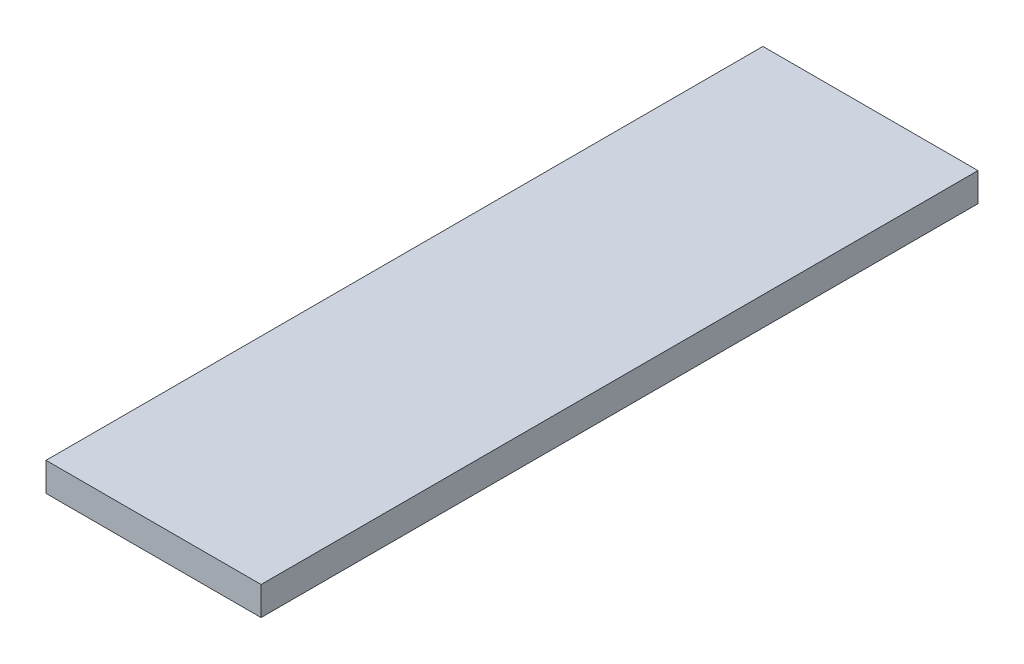
from build123d import *

# Parameters (mm, degrees)
SKETCH1_W           = 150
SKETCH1_H           = 20
BOSS_EXTRUDE1_DEPTH = 500


with BuildPart() as part:
    # Sketch1 → Boss-Extrude1 (new body)
    with BuildSketch(Plane.XY):
        with Locations((75, 10)):
            Rectangle(SKETCH1_W, SKETCH1_H)
    extrude(amount=BOSS_EXTRUDE1_DEPTH)


solid = part.part
